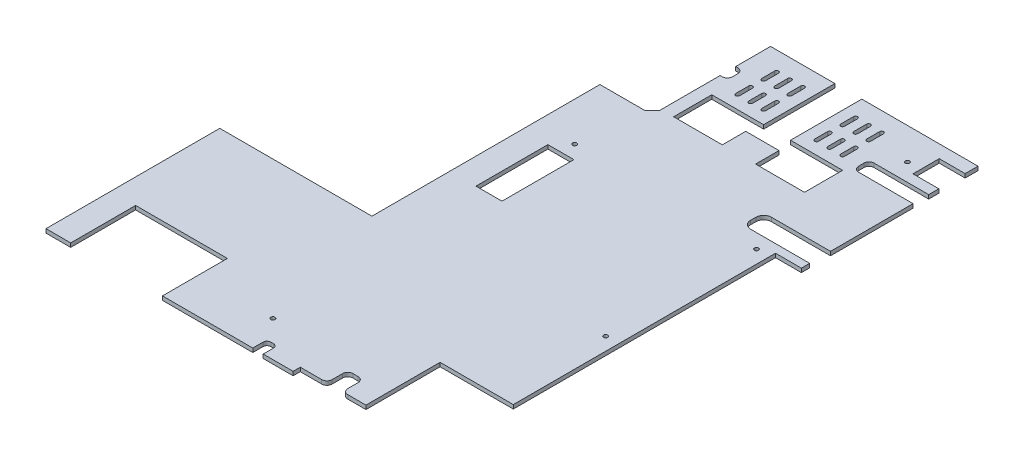
from build123d import *

# Parameters (mm, degrees)
SKETCH1_W           = 20
SKETCH1_H           = 55.3
BOSS_EXTRUDE1_DEPTH = 3
CUT_EXTRUDE1_DEPTH  = 28
SKETCH3_R           = 1.6
CUT_EXTRUDE2_DEPTH  = 10
CUT_EXTRUDE3_DEPTH  = 10
CUT_EXTRUDE4_DEPTH  = 10
THICKEN1_T1         = 19.9
SKETCH7_W           = 6.4
SKETCH7_H           = 3
SKETCH7_W_2         = 7.8
SKETCH7_W_3         = 9.9
BOSS_EXTRUDE3_DEPTH = 19.9


with BuildPart() as part:
    # Sketch1 → Boss-Extrude1 (new body)
    with BuildSketch(Plane.XZ.offset(561.298939869)):
        with BuildLine():
            Line((-328.210843614, 789.520141885), (-309.210843614, 789.520141885))
            Line((-309.210843614, 789.520141885), (-309.210843614, 739.620141885))
            Line((-309.210843614, 739.620141885), (-238.660843614, 739.620141885))
            Line((-238.660843614, 739.620141885), (-238.660843614, 789.520141885))
            Line((-238.660843614, 789.520141885), (-138.210843614, 789.520141885))
            Line((-138.210843614, 789.520141885), (-138.210843614, 786.020141885))
            Line((-138.210843614, 786.020141885), (-138.210843614, 784.020141885))
            Line((-138.210843614, 784.020141885), (-121.693711685, 784.020141885))
            ThreePointArc((-121.693711685, 784.020141885), (-118.86528456, 782.848569009), (-117.693711685, 780.020141885))
            Line((-117.693711685, 780.020141885), (-117.693711685, 772.020141885))
            ThreePointArc((-117.693711685, 772.020141885), (-116.52213881, 769.19171476), (-113.693711685, 768.020141885))
            Line((-113.693711685, 768.020141885), (-109.693711685, 768.020141885))
            ThreePointArc((-109.693711685, 768.020141885), (-106.86528456, 769.19171476), (-105.693711685, 772.020141885))
            Line((-105.693711685, 772.020141885), (-105.693711685, 780.020141885))
            ThreePointArc((-105.693711685, 780.020141885), (-104.52213881, 782.848569009), (-101.693711685, 784.020141885))
            Line((-101.693711685, 784.020141885), (-87.710843614, 784.020141885))
            Line((-87.710843614, 784.020141885), (-87.710843614, 727.020141885))
            Line((-87.710843614, 727.020141885), (-31.410843614, 727.020141885))
            Line((-31.410843614, 727.020141885), (-31.410843614, 555.620141885))
            Line((-31.410843614, 555.620141885), (-31.410843614, 480.920141885))
            Line((-31.410843614, 480.920141885), (-31.410843614, 389.620141885))
            Line((-31.410843614, 389.620141885), (-60.710843614, 389.620141885))
            Line((-60.710843614, 389.620141885), (-100.860843614, 389.620141885))
            Line((-100.860843614, 389.620141885), (-100.860843614, 444.420141885))
            Line((-100.860843614, 444.420141885), (-60.818241118, 444.420141885))
            Line((-60.818241118, 444.420141885), (-60.818241118, 473.720141885))
            Line((-60.818241118, 473.720141885), (-98.410843614, 473.720141885))
            Line((-98.410843614, 473.720141885), (-98.410843614, 455.720141885))
            Line((-98.410843614, 455.720141885), (-124.010843614, 455.720141885))
            Line((-124.010843614, 455.720141885), (-124.010843614, 473.720141885))
            Line((-124.010843614, 473.720141885), (-161.418241118, 473.720141885))
            Line((-161.418241118, 473.720141885), (-161.418241118, 444.420141885))
            Line((-161.418241118, 444.420141885), (-121.560843614, 444.420141885))
            Line((-121.560843614, 444.420141885), (-121.560843614, 389.620141885))
            Line((-121.560843614, 389.620141885), (-161.410843614, 389.620141885))
            Line((-161.410843614, 389.620141885), (-171.010843614, 389.620141885))
            Line((-171.010843614, 389.620141885), (-171.010843614, 416.420141885))
            Line((-171.010843614, 416.420141885), (-169.410843614, 416.420141885))
            ThreePointArc((-169.410843614, 416.420141885), (-166.582416489, 417.59171476), (-165.410843614, 420.420141885))
            Line((-165.410843614, 420.420141885), (-165.410843614, 424.420141885))
            ThreePointArc((-165.410843614, 424.420141885), (-166.582416489, 427.248569009), (-169.410843614, 428.420141885))
            Line((-169.410843614, 428.420141885), (-171.010843614, 428.420141885))
            Line((-171.010843614, 428.420141885), (-171.010843614, 473.620141885))
            Line((-171.010843614, 473.620141885), (-171.010843614, 475.020141885))
            Line((-171.010843614, 475.020141885), (-176.610843614, 480.620141885))
            Line((-176.610843614, 480.620141885), (-191.210843614, 480.620141885))
            Line((-191.210843614, 480.620141885), (-211.210843614, 480.620141885))
            Line((-211.210843614, 480.620141885), (-211.210843614, 530.620141885))
            Line((-211.210843614, 530.620141885), (-211.210843614, 605.920141885))
            Line((-211.210843614, 605.920141885), (-211.210843614, 655.920141885))
            Line((-211.210843614, 655.920141885), (-328.210843614, 655.920141885))
            Line((-328.210843614, 655.920141885), (-328.210843614, 789.520141885))
        make_face()
        with Locations((-181.210843614, 568.270141885)):
            Rectangle(SKETCH1_W, SKETCH1_H, mode=Mode.SUBTRACT)
    extrude(amount=BOSS_EXTRUDE1_DEPTH)

    # Sketch2 → Cut-Extrude1 (cut)
    with BuildSketch(Plane(origin=(0, -548.298939869, 0), x_dir=(1, 0, 0), z_dir=(0, 1, 0))):
        with BuildLine():
            Line((-169.210843614, -786.620139379), (-169.210843614, -781.620139379))
            ThreePointArc((-169.210843614, -781.620139379), (-168.332163957, -779.498819035), (-166.210843614, -778.620139379))
            Line((-166.210843614, -778.620139379), (-164.210843614, -778.620139379))
            ThreePointArc((-164.210843614, -778.620139379), (-162.08952327, -779.498819035), (-161.210843614, -781.620139379))
            Line((-161.210843614, -781.620139379), (-161.210843614, -786.620139379))
            Line((-161.210843614, -786.620139379), (-161.210843614, -789.520141885))
            Line((-161.210843614, -789.520141885), (-169.210843614, -789.520141885))
            Line((-169.210843614, -789.520141885), (-169.210843614, -786.620139379))
        make_face()
        Polygon((-53.210843614, -786.620139379), (-61.210843614, -786.620139379), (-61.210843614, -778.620139379), (-61.210843614, -766.620139379), (-53.210843614, -766.620139379), (-53.210843614, -778.620139379), align=None)
    extrude(amount=-CUT_EXTRUDE1_DEPTH, mode=Mode.SUBTRACT)

    # Sketch3 → Cut-Extrude2 (cut)
    with BuildSketch(Plane.XZ.offset(564.298939869)):
        with Locations((-41.410843614, 646.020141885)):
            Circle(SKETCH3_R)
        with Locations((-41.410843614, 530.020141885)):
            Circle(SKETCH3_R)
        with Locations((-201.210843614, 876.282996741)):
            Circle(SKETCH3_R)
        with Locations((-181.210843614, 530.020141885)):
            Circle(SKETCH3_R)
        with Locations((-41.410843614, 414.020141885)):
            Circle(SKETCH3_R)
        with Locations((-181.210843614, 762.020141885)):
            Circle(SKETCH3_R)
    extrude(amount=-CUT_EXTRUDE2_DEPTH, mode=Mode.SUBTRACT)

    # Sketch4 → Cut-Extrude3 (cut)
    with BuildSketch(Plane.XZ.offset(564.298939869)):
        with BuildLine():
            Line((-56.910843614, 519.020141885), (-51.410843614, 519.020141885))
            Line((-51.410843614, 519.020141885), (-31.410843614, 519.020141885))
            Line((-31.410843614, 519.020141885), (-31.410843614, 503.020141885))
            Line((-31.410843614, 503.020141885), (-52.910843614, 503.020141885))
            Line((-52.910843614, 503.020141885), (-56.910843614, 503.020141885))
            ThreePointArc((-56.910843614, 503.020141885), (-61.153484301, 504.777501198), (-62.910843614, 509.020141885))
            Line((-62.910843614, 509.020141885), (-62.910843614, 513.020141885))
            ThreePointArc((-62.910843614, 513.020141885), (-61.153484301, 517.262782572), (-56.910843614, 519.020141885))
        make_face()
        with BuildLine():
            Line((-31.410843614, 427.520141885), (-53.410843614, 427.520141885))
            ThreePointArc((-53.410843614, 427.520141885), (-56.239270738, 428.69171476), (-57.410843614, 431.520141885))
            Line((-57.410843614, 431.520141885), (-57.410843614, 435.520141885))
            ThreePointArc((-57.410843614, 435.520141885), (-56.239270738, 438.348569009), (-53.410843614, 439.520141885))
            Line((-53.410843614, 439.520141885), (-31.410843614, 439.520141885))
            Line((-31.410843614, 439.520141885), (-31.410843614, 427.520141885))
        make_face()
    extrude(amount=-CUT_EXTRUDE3_DEPTH, mode=Mode.SUBTRACT)

    # Sketch5 → Cut-Extrude4 (cut)
    with BuildSketch(Plane.XZ.offset(564.298939869)):
        with BuildLine():
            Line((-130.060843614, 434.420141885), (-130.060843614, 424.420141885))
            ThreePointArc((-130.060843614, 424.420141885), (-131.560843614, 422.920141885), (-133.060843614, 424.420141885))
            Line((-133.060843614, 424.420141885), (-133.060843614, 434.420141885))
            ThreePointArc((-133.060843614, 434.420141885), (-131.560843614, 435.920141885), (-130.060843614, 434.420141885))
        make_face()
        with BuildLine():
            Line((-140.060843614, 434.420141885), (-140.060843614, 424.420141885))
            ThreePointArc((-140.060843614, 424.420141885), (-141.560843614, 422.920141885), (-143.060843614, 424.420141885))
            Line((-143.060843614, 424.420141885), (-143.060843614, 434.420141885))
            ThreePointArc((-143.060843614, 434.420141885), (-141.560843614, 435.920141885), (-140.060843614, 434.420141885))
        make_face()
        with BuildLine():
            Line((-150.060843614, 434.420141885), (-150.060843614, 424.420141885))
            ThreePointArc((-150.060843614, 424.420141885), (-151.560843614, 422.920141885), (-153.060843614, 424.420141885))
            Line((-153.060843614, 424.420141885), (-153.060843614, 434.420141885))
            ThreePointArc((-153.060843614, 434.420141885), (-151.560843614, 435.920141885), (-150.060843614, 434.420141885))
        make_face()
        with BuildLine():
            Line((-140.060843614, 414.420141885), (-140.060843614, 404.420141885))
            ThreePointArc((-140.060843614, 404.420141885), (-141.560843614, 402.920141885), (-143.060843614, 404.420141885))
            Line((-143.060843614, 404.420141885), (-143.060843614, 414.420141885))
            ThreePointArc((-143.060843614, 414.420141885), (-141.560843614, 415.920141885), (-140.060843614, 414.420141885))
        make_face()
        with BuildLine():
            Line((-150.060843614, 414.420141885), (-150.060843614, 404.420141885))
            ThreePointArc((-150.060843614, 404.420141885), (-151.560843614, 402.920141885), (-153.060843614, 404.420141885))
            Line((-153.060843614, 404.420141885), (-153.060843614, 414.420141885))
            ThreePointArc((-153.060843614, 414.420141885), (-151.560843614, 415.920141885), (-150.060843614, 414.420141885))
        make_face()
        with BuildLine():
            Line((-130.060843614, 414.420141885), (-130.060843614, 404.420141885))
            ThreePointArc((-130.060843614, 404.420141885), (-131.560843614, 402.920141885), (-133.060843614, 404.420141885))
            Line((-133.060843614, 404.420141885), (-133.060843614, 414.420141885))
            ThreePointArc((-133.060843614, 414.420141885), (-131.560843614, 415.920141885), (-130.060843614, 414.420141885))
        make_face()
        with BuildLine():
            Line((-69.360843614, 434.420141885), (-69.360843614, 424.420141885))
            ThreePointArc((-69.360843614, 424.420141885), (-70.860843614, 422.920141885), (-72.360843614, 424.420141885))
            Line((-72.360843614, 424.420141885), (-72.360843614, 434.420141885))
            ThreePointArc((-72.360843614, 434.420141885), (-70.860843614, 435.920141885), (-69.360843614, 434.420141885))
        make_face()
        with BuildLine():
            Line((-79.360843614, 434.420141885), (-79.360843614, 424.420141885))
            ThreePointArc((-79.360843614, 424.420141885), (-80.860843614, 422.920141885), (-82.360843614, 424.420141885))
            Line((-82.360843614, 424.420141885), (-82.360843614, 434.420141885))
            ThreePointArc((-82.360843614, 434.420141885), (-80.860843614, 435.920141885), (-79.360843614, 434.420141885))
        make_face()
        with BuildLine():
            Line((-89.360843614, 434.420141885), (-89.360843614, 424.420141885))
            ThreePointArc((-89.360843614, 424.420141885), (-90.860843614, 422.920141885), (-92.360843614, 424.420141885))
            Line((-92.360843614, 424.420141885), (-92.360843614, 434.420141885))
            ThreePointArc((-92.360843614, 434.420141885), (-90.860843614, 435.920141885), (-89.360843614, 434.420141885))
        make_face()
        with BuildLine():
            Line((-79.360843614, 414.420141885), (-79.360843614, 404.420141885))
            ThreePointArc((-79.360843614, 404.420141885), (-80.860843614, 402.920141885), (-82.360843614, 404.420141885))
            Line((-82.360843614, 404.420141885), (-82.360843614, 414.420141885))
            ThreePointArc((-82.360843614, 414.420141885), (-80.860843614, 415.920141885), (-79.360843614, 414.420141885))
        make_face()
        with BuildLine():
            Line((-89.360843614, 414.420141885), (-89.360843614, 404.420141885))
            ThreePointArc((-89.360843614, 404.420141885), (-90.860843614, 402.920141885), (-92.360843614, 404.420141885))
            Line((-92.360843614, 404.420141885), (-92.360843614, 414.420141885))
            ThreePointArc((-92.360843614, 414.420141885), (-90.860843614, 415.920141885), (-89.360843614, 414.420141885))
        make_face()
        with BuildLine():
            Line((-69.360843614, 414.420141885), (-69.360843614, 404.420141885))
            ThreePointArc((-69.360843614, 404.420141885), (-70.860843614, 402.920141885), (-72.360843614, 404.420141885))
            Line((-72.360843614, 404.420141885), (-72.360843614, 414.420141885))
            ThreePointArc((-72.360843614, 414.420141885), (-70.860843614, 415.920141885), (-69.360843614, 414.420141885))
        make_face()
    extrude(amount=-CUT_EXTRUDE4_DEPTH, mode=Mode.SUBTRACT)

    # Surface-Offset1: a surface, a copy of 1 face of the part
    surface_offset1_1 = part.part.faces().sort_by_distance((-31.410843614, -562.798939869, 471.270141885))[0]
    add(Solid.thicken(surface_offset1_1, THICKEN1_T1))

    # Sketch7 → Boss-Extrude3 (add)
    with BuildSketch(Plane(origin=(-31.410843614, 0, 0), x_dir=(0, 0, -1), z_dir=(1, 0, 0))):
        with Locations((-522.220141885, -562.798939869)):
            Rectangle(SKETCH7_W, SKETCH7_H)
        with Locations((-423.620141885, -562.798939869)):
            Rectangle(SKETCH7_W_2, SKETCH7_H)
        with Locations((-394.570141885, -562.798939869)):
            Rectangle(SKETCH7_W_3, SKETCH7_H)
    extrude(amount=BOSS_EXTRUDE3_DEPTH)


solid = part.part
